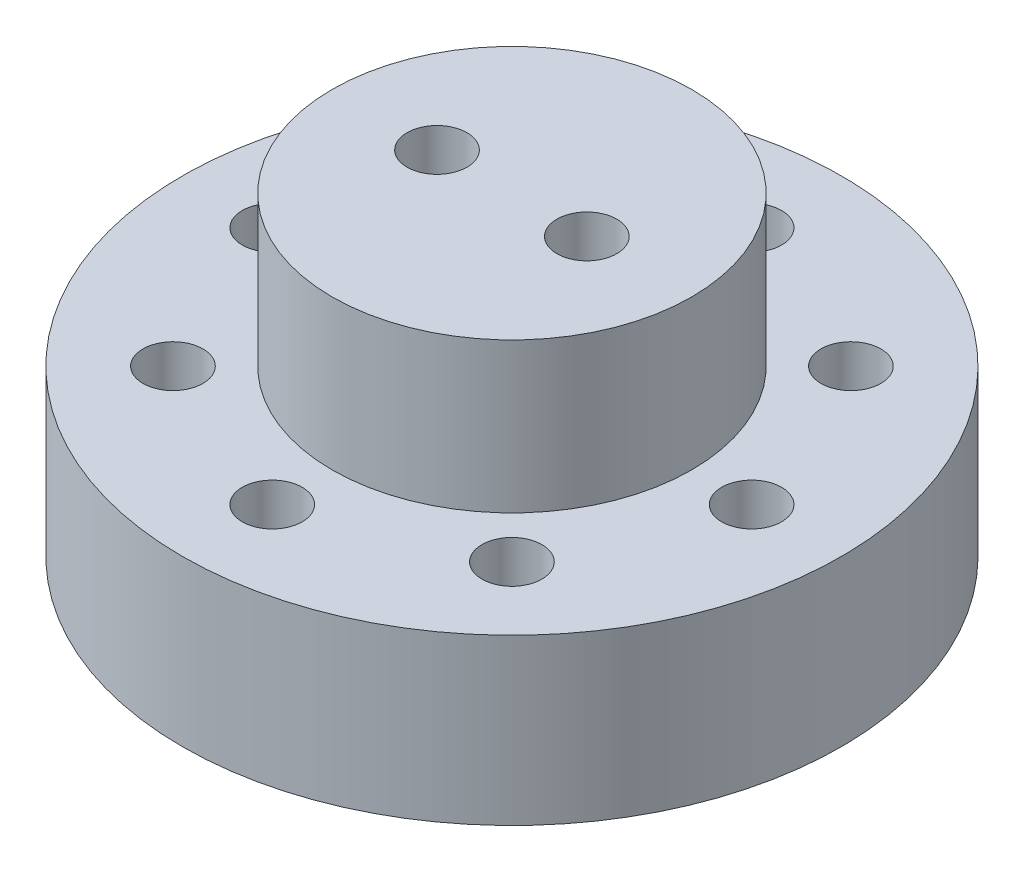
from build123d import *

# Parameters (mm, degrees)
SKETCH1_R           = 11
SKETCH1_R_2         = 1
BOSS_EXTRUDE1_DEPTH = 5.5
SKETCH2_R           = 4
CUT_EXTRUDE1_DEPTH  = 17.5
SKETCH9_R           = 6
BOSS_EXTRUDE4_DEPTH = 5
SKETCH10_R          = 1
CUT_EXTRUDE6_DEPTH  = 19.768324379


with BuildPart() as part:
    # Sketch1 → Boss-Extrude1 (new body)
    with BuildSketch(Plane(origin=(0, 0, 0), x_dir=(1, 0, 0), z_dir=(0, 1, 0))):
        Circle(SKETCH1_R)
        with Locations((0, 8)):
            Circle(SKETCH1_R_2, mode=Mode.SUBTRACT)
        with Locations((5.656854249, 5.656854249)):
            Circle(SKETCH1_R_2, mode=Mode.SUBTRACT)
        with Locations((8, 0)):
            Circle(SKETCH1_R_2, mode=Mode.SUBTRACT)
        with Locations((5.656854249, -5.656854249)):
            Circle(SKETCH1_R_2, mode=Mode.SUBTRACT)
        with Locations((0, -8)):
            Circle(SKETCH1_R_2, mode=Mode.SUBTRACT)
        with Locations((-5.656854249, -5.656854249)):
            Circle(SKETCH1_R_2, mode=Mode.SUBTRACT)
        with Locations((-8, 0)):
            Circle(SKETCH1_R_2, mode=Mode.SUBTRACT)
        with Locations((-5.656854249, 5.656854249)):
            Circle(SKETCH1_R_2, mode=Mode.SUBTRACT)
    extrude(amount=BOSS_EXTRUDE1_DEPTH)

    # Sketch2 → Cut-Extrude1 (cut, through all)
    with BuildSketch(Plane(origin=(0, 5.5, 0), x_dir=(1, 0, 0), z_dir=(0, 1, 0))):
        Circle(SKETCH2_R)
    extrude(amount=-CUT_EXTRUDE1_DEPTH, mode=Mode.SUBTRACT)

    # Sketch9 → Boss-Extrude4 (add)
    with BuildSketch(Plane(origin=(0, 5.5, 0), x_dir=(1, 0, 0), z_dir=(0, 1, 0))):
        Circle(SKETCH9_R)
    extrude(amount=BOSS_EXTRUDE4_DEPTH)

    # Sketch10 → Cut-Extrude6 (cut, through all)
    with BuildSketch(Plane(origin=(0, 10.5, 0), x_dir=(1, 0, 0), z_dir=(0, 1, 0))):
        with Locations((-2.5, 0)):
            Circle(SKETCH10_R)
        with Locations((2.5, 0)):
            Circle(SKETCH10_R)
    extrude(amount=-CUT_EXTRUDE6_DEPTH, mode=Mode.SUBTRACT)


solid = part.part
